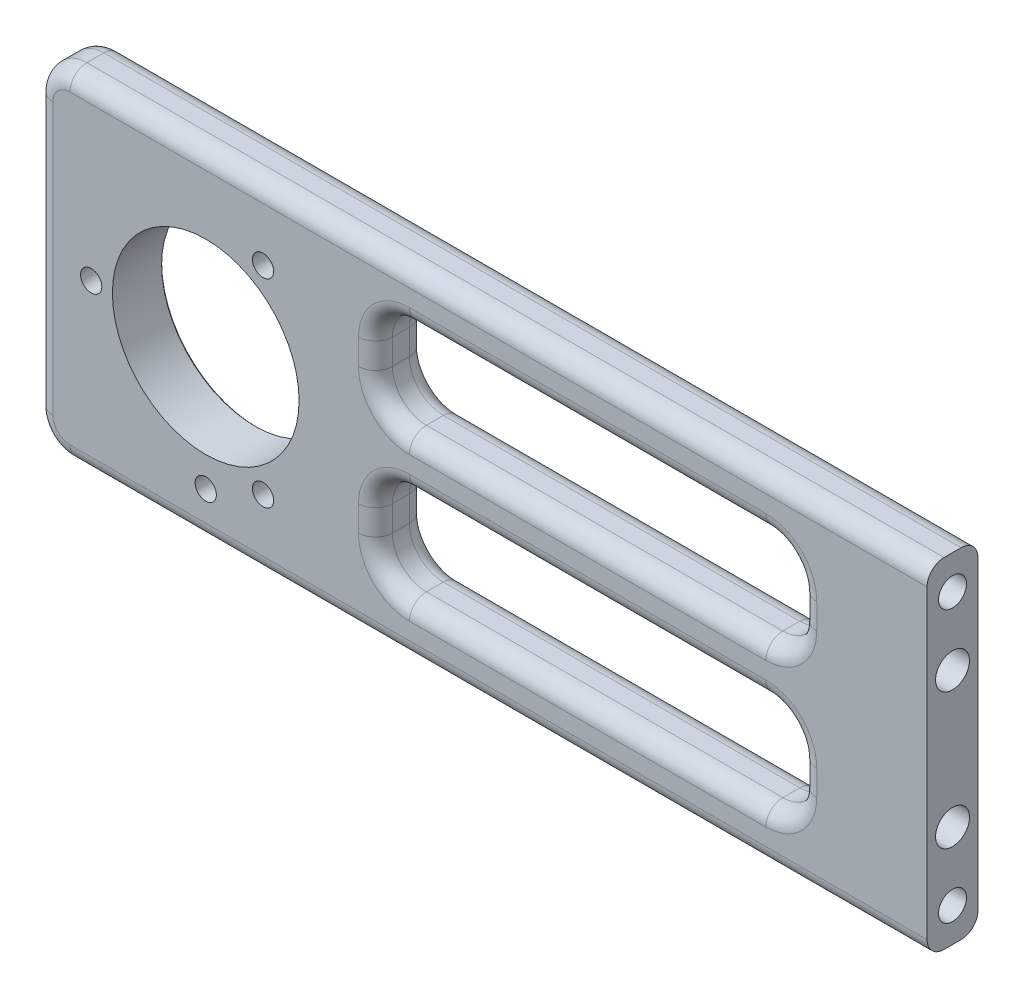
from build123d import *

# Parameters (mm, degrees)
ESQUISSE1_R                       = 11
BOSS_EXTRU_1_DEPTH                = 6
ENL_V_MAT_EXTRU_5_REACH           = 89.527
CONG_1_R                          = 2
TROU_TARAUD_M31_D                 = 2.5
TROU_TARAUD_M33_D                 = 2.5
CHANFREIN1_SIZE                   = 0.2
DIAM_TRE_DU_PER_AGE_4_0_4_1_D     = 4
DIAM_TRE_DU_PER_AGE_4_0_4_1_DEPTH = 5
DIAM_TRE_DU_PER_AGE_4_0_4_1_TIP   = 1.201721238
TROU_TARAUD_M41_D                 = 3.3
TROU_TARAUD_M41_DEPTH             = 11.5
TROU_TARAUD_M41_TIP               = 0.991420021


with BuildPart() as part:
    # Esquisse1 → Boss.-Extru.1 (new body)
    with BuildSketch(Plane.XY):
        with BuildLine():
            Line((-16, 20), (85, 20))
            Line((85, 20), (85, -20))
            Line((85, -20), (-16, -20))
            ThreePointArc((-16, -20), (-18.828427125, -18.828427125), (-20, -16))
            Line((-20, -16), (-20, 16))
            ThreePointArc((-20, 16), (-18.828427125, 18.828427125), (-16, 20))
        make_face()
        Circle(ESQUISSE1_R, mode=Mode.SUBTRACT)
    extrude(amount=BOSS_EXTRU_1_DEPTH)

    # Esquisse16 → Enlèv. mat.-Extru.5 (cut, up to next)
    with BuildSketch(Plane.XY, mode=Mode.PRIVATE) as enl_v_mat_extru_5_sk1:
        with BuildLine():
            Line((20, 10), (20, 7))
            ThreePointArc((20, 7), (21.171572875, 4.171572875), (24, 3))
            Line((24, 3), (66, 3))
            ThreePointArc((66, 3), (68.828427125, 4.171572875), (70, 7))
            Line((70, 7), (70, 10))
            ThreePointArc((70, 10), (68.828427125, 12.828427125), (66, 14))
            Line((66, 14), (24, 14))
            ThreePointArc((24, 14), (21.171572875, 12.828427125), (20, 10))
        make_face()
    enl_v_mat_extru_5_tool1 = extrude(enl_v_mat_extru_5_sk1.sketch, amount=ENL_V_MAT_EXTRU_5_REACH, mode=Mode.PRIVATE) & part.part
    # Esquisse16 → Enlèv. mat.-Extru.5 (cut, up to next)
    with BuildSketch(Plane.XY, mode=Mode.PRIVATE) as enl_v_mat_extru_5_sk2:
        with BuildLine():
            Line((70, -7), (70, -10))
            ThreePointArc((70, -10), (68.828427125, -12.828427125), (66, -14))
            Line((66, -14), (24, -14))
            ThreePointArc((24, -14), (21.171572875, -12.828427125), (20, -10))
            Line((20, -10), (20, -7))
            ThreePointArc((20, -7), (21.171572875, -4.171572875), (24, -3))
            Line((24, -3), (66, -3))
            ThreePointArc((66, -3), (68.828427125, -4.171572875), (70, -7))
        make_face()
    enl_v_mat_extru_5_tool2 = extrude(enl_v_mat_extru_5_sk2.sketch, amount=ENL_V_MAT_EXTRU_5_REACH, mode=Mode.PRIVATE) & part.part
    add(enl_v_mat_extru_5_tool1.solids().sort_by_distance((45, 8.5, 0))[0], mode=Mode.SUBTRACT)
    add(enl_v_mat_extru_5_tool2.solids().sort_by_distance((45, -8.5, 0))[0], mode=Mode.SUBTRACT)

    # Congé1
    cong_1_edges = [part.edges().sort_by_distance(p)[0] for p in [
        (34.5, 20, 6),
        (-18.828427125, 18.828427125, 6),
        (-20, 0, 6),
        (68.828427125, 4.171572875, 6),
        (68.828427125, 4.171572875, 0),
        (70, 8.5, 6),
        (70, 8.5, 0),
        (68.828427125, 12.828427125, 6),
        (68.828427125, 12.828427125, 0),
        (45, 14, 6),
        (45, 14, 0),
        (21.171572875, 12.828427125, 6),
        (21.171572875, 12.828427125, 0),
        (20, 8.5, 6),
        (20, 8.5, 0),
        (21.171572875, 4.171572875, 6),
        (21.171572875, 4.171572875, 0),
        (45, 3, 6),
        (45, 3, 0),
        (-18.828427125, -18.828427125, 6),
        (68.828427125, -12.828427125, 6),
        (68.828427125, -12.828427125, 0),
        (70, -8.5, 6),
        (70, -8.5, 0),
        (68.828427125, -4.171572875, 6),
        (68.828427125, -4.171572875, 0),
        (45, -3, 6),
        (45, -3, 0),
        (21.171572875, -4.171572875, 6),
        (21.171572875, -4.171572875, 0),
        (20, -8.5, 6),
        (20, -8.5, 0),
        (21.171572875, -12.828427125, 6),
        (21.171572875, -12.828427125, 0),
        (45, -14, 6),
        (45, -14, 0),
        (-20, 0, 0),
        (-18.828427125, 18.828427125, 0),
        (34.5, 20, 0),
        (34.5, -20, 6),
        (34.5, -20, 0),
        (-18.828427125, -18.828427125, 0),
    ]]
    fillet(cong_1_edges, radius=CONG_1_R)

    # Trou taraudé M31 (through all)
    with Locations(Plane(origin=(0, 0, 0), x_dir=(-1, 0, 0), z_dir=(0, 0, -1))):
        with Locations((0, -14.5)):
            Hole(TROU_TARAUD_M31_D / 2)

    # Trou taraudé M33 (through all)
    with Locations(Plane(origin=(0, 0, 0), x_dir=(-1, 0, 0), z_dir=(0, 0, -1))):
        with Locations((-6.75, 11.691342951), (-6.75, -11.691342951), (13.5, 0)):
            Hole(TROU_TARAUD_M33_D / 2)

    # Chanfrein1
    chanfrein1_edges = [part.edges().sort_by_distance(p)[0] for p in [
        (-11, 0, 0),
    ]]
    chamfer(chanfrein1_edges, length=CHANFREIN1_SIZE)

    # Diamètre du perçage Ø4.0 (4)1
    with Locations(Plane(origin=(85, 0, 0), x_dir=(0, 0, -1), z_dir=(1, 0, 0))):
        with Locations((-3, 8), (-3, -8)):
            Hole(DIAM_TRE_DU_PER_AGE_4_0_4_1_D / 2, depth=DIAM_TRE_DU_PER_AGE_4_0_4_1_DEPTH)
            with Locations((0, 0, -(DIAM_TRE_DU_PER_AGE_4_0_4_1_DEPTH + DIAM_TRE_DU_PER_AGE_4_0_4_1_TIP / 2))):  # 118° drill point
                Cone(0, DIAM_TRE_DU_PER_AGE_4_0_4_1_D / 2, DIAM_TRE_DU_PER_AGE_4_0_4_1_TIP, mode=Mode.SUBTRACT)

    # Trou taraudé M41
    with Locations(Plane(origin=(85, 0, 0), x_dir=(0, 0, -1), z_dir=(1, 0, 0))):
        with Locations((-3, 16), (-3, -16)):
            Hole(TROU_TARAUD_M41_D / 2, depth=TROU_TARAUD_M41_DEPTH)
            with Locations((0, 0, -(TROU_TARAUD_M41_DEPTH + TROU_TARAUD_M41_TIP / 2))):  # 118° drill point
                Cone(0, TROU_TARAUD_M41_D / 2, TROU_TARAUD_M41_TIP, mode=Mode.SUBTRACT)


solid = part.part
